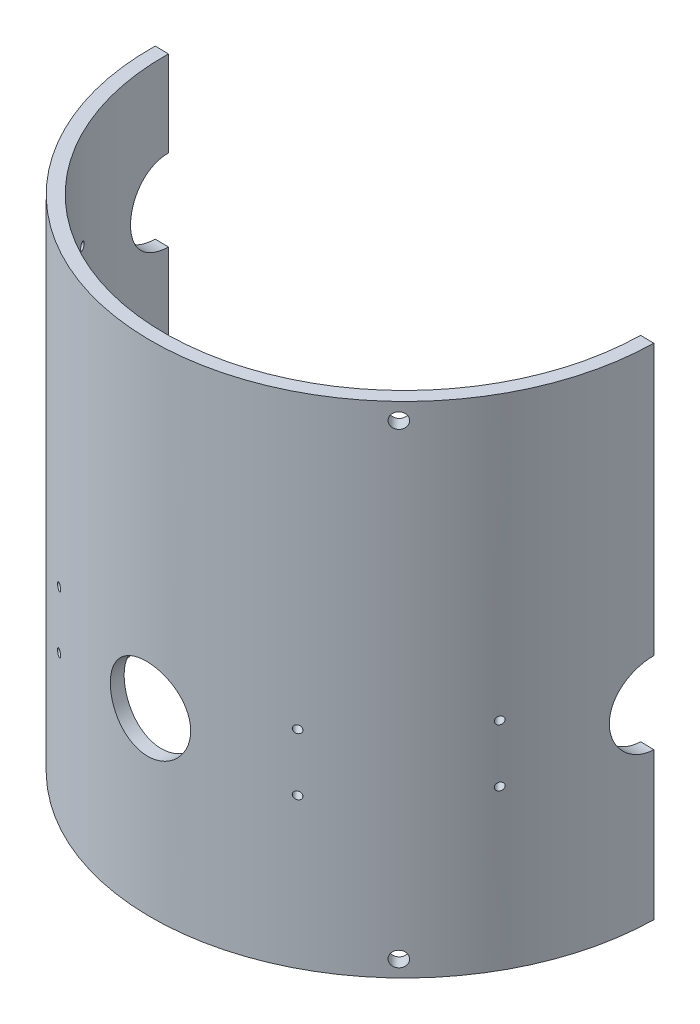
from build123d import *

# Parameters (mm, degrees)
BOSS_EXTRUDE1_DEPTH      = 130.8
SKETCH5_R                = 10.65
CUT_EXTRUDE4_DEPTH       = 129.8
SKETCH6_R                = 10.65
CUT_EXTRUDE5_DEPTH       = 129.8
SKETCH57_R               = 10.7
CUT_EXTRUDE48_DEPTH      = 148.028127911
CUT_EXTRUDE51_DEPTH      = 132.35522197
CUT_EXTRUDE51_DEPTH_BACK = 132.35522197
SKETCH60_R               = 2
CUT_EXTRUDE52_DEPTH      = 132.574432074
CUT_EXTRUDE52_DEPTH_BACK = 132.574432074
SKETCH61_R               = 2.000000001
SKETCH63_R               = 1
CUT_EXTRUDE53_DEPTH      = 155.429604817
SKETCH64_R               = 1
CUT_EXTRUDE54_DEPTH      = 157.678735431
SKETCH65_R               = 1
CUT_EXTRUDE55_DEPTH      = 157.678735431
SKETCH66_R               = 1
CUT_EXTRUDE56_DEPTH      = 155.429604817


with BuildPart() as part:
    # Sketch1 → Boss-Extrude1 (new body)
    with BuildSketch(Plane(origin=(0, 0, 0), x_dir=(0.999872775920664, 0, 0.01595092388251422), z_dir=(0, 1, 0))):
        with BuildLine():
            Line((70.372282363, 4.818066557), (66.856282363, 4.818066557))
            ThreePointArc((66.856282363, 4.818066557), (4.002282363, -58.035933443), (-58.851717637, 4.818066557))
            Line((-58.851717637, 4.818066557), (-62.367717637, 4.818066557))
            ThreePointArc((-62.367717637, 4.818066557), (4.002282363, -61.551933443), (70.372282363, 4.818066557))
        make_face()
    extrude(amount=BOSS_EXTRUDE1_DEPTH)

    # Sketch5 → Cut-Extrude4 (cut)
    with BuildSketch(Plane(origin=(63.687908888, 47.899932993, -8.621348971), x_dir=(0.015950923882504298, 0, -0.9998727759206641), z_dir=(0.9998727759206643, 0, 0.015950923882504298))):
        with Locations((-4.818066557, 1.350067007)):
            Circle(SKETCH5_R)
    extrude(amount=CUT_EXTRUDE4_DEPTH, mode=Mode.SUBTRACT)

    # Sketch6 → Cut-Extrude5 (cut)
    with BuildSketch(Plane(origin=(-55.376952084, 47.899932993, -10.520785159), x_dir=(-0.01595092388248271, 0, 0.9998727759206645), z_dir=(-0.9998727759206645, 0, -0.01595092388248271))):
        with Locations((4.818066557, 49.750067007)):
            Circle(SKETCH6_R)
    extrude(amount=CUT_EXTRUDE5_DEPTH, mode=Mode.SUBTRACT)

    # Sketch57 → Cut-Extrude48 (cut, through all)
    with BuildSketch(Plane(origin=(-1.335920715, 38.899932993, 83.74127818), x_dir=(0.999872775920664, 0, 0.015950923882512152), z_dir=(-0.015950923882512152, 0, 0.999872775920664))):
        with Locations((4.002282363, 7.900067007)):
            Circle(SKETCH57_R)
    extrude(amount=-CUT_EXTRUDE48_DEPTH, mode=Mode.SUBTRACT)

    # Sketch60 → Cut-Extrude51 (cut, two sides: drawn at the far end of the back side and taken through both)
    with BuildSketch(Plane(origin=(4.479542792, 38.899932993, -4.33978545), x_dir=(0.6958141043149662, 0, 0.7182219240850013), z_dir=(-0.7182219240850013, 0, 0.6958141043149662)).offset(-CUT_EXTRUDE51_DEPTH_BACK)):
        with Locations(Location((-0.576184071, 87.550067007, 0), (0, 0, 180))):
            Circle(SKETCH60_R)
        with Locations(Location((-0.576184071, -34.599932993, 0), (0, 0, 180))):
            Circle(SKETCH60_R)
    extrude(amount=CUT_EXTRUDE51_DEPTH + CUT_EXTRUDE51_DEPTH_BACK, mode=Mode.SUBTRACT)

    # Sketch61 → Cut-Extrude52 (cut, two sides: drawn at the far end of the back side and taken through both)
    with BuildSketch(Plane(origin=(-0.400917003, 38.899932993, -0.413828032), x_dir=(0.7182219240850013, 0, -0.6958141043149662), z_dir=(0.6958141043149662, 0, 0.7182219240850013)).offset(-CUT_EXTRUDE52_DEPTH_BACK)):
        with Locations((6.236989769, 87.550067007)):
            Circle(SKETCH61_R)
        with Locations((6.236989769, -34.599932997)):
            Circle(SKETCH61_R)
    extrude(amount=CUT_EXTRUDE52_DEPTH + CUT_EXTRUDE52_DEPTH_BACK, mode=Mode.SUBTRACT)

    # Sketch63 → Cut-Extrude53 (cut, through all)
    with BuildSketch(Plane(origin=(48.51495843, 38.899932993, 50.087966302), x_dir=(0.718295826620825, 0, -0.6957378137338129), z_dir=(0.6957378137338129, 0, 0.718295826620825))):
        with Locations((-12.551102324, 15.400067007)):
            Circle(SKETCH63_R)
        with Locations((-12.551102324, 0.400067007)):
            Circle(SKETCH63_R)
    extrude(amount=-CUT_EXTRUDE53_DEPTH, mode=Mode.SUBTRACT)

    # Sketch64 → Cut-Extrude54 (cut, through all)
    with BuildSketch(Plane(origin=(-46.022353024, 38.899932993, 44.577025355), x_dir=(0.6957378137337953, 0, 0.7182958266208421), z_dir=(-0.7182958266208421, 0, 0.6957378137337953))):
        with Locations((18.069559284, 15.400067007)):
            Circle(SKETCH64_R)
        with Locations((18.069559284, 0.400067007)):
            Circle(SKETCH64_R)
    extrude(amount=-CUT_EXTRUDE54_DEPTH, mode=Mode.SUBTRACT)

    # Sketch65 → Cut-Extrude55 (cut, through all)
    with BuildSketch(Plane(origin=(-46.022353024, 38.899932993, 44.577025355), x_dir=(0.6957378137338341, 0, 0.7182958266208045), z_dir=(-0.7182958266208045, 0, 0.6957378137338341))):
        with Locations((-19.364877393, 66.250067007)):
            Circle(SKETCH65_R)
        with Locations((-19.364877393, 51.250067007)):
            Circle(SKETCH65_R)
    extrude(amount=-CUT_EXTRUDE55_DEPTH, mode=Mode.SUBTRACT)

    # Sketch66 → Cut-Extrude56 (cut, through all)
    with BuildSketch(Plane(origin=(48.51495843, 38.899932993, 50.087966302), x_dir=(0.7182958266208437, 0, -0.6957378137337936), z_dir=(0.6957378137337936, 0, 0.7182958266208437))):
        with Locations((24.883334353, 17.850067007)):
            Circle(SKETCH66_R)
        with Locations((24.883334353, 2.850067007)):
            Circle(SKETCH66_R)
    extrude(amount=-CUT_EXTRUDE56_DEPTH, mode=Mode.SUBTRACT)


solid = part.part
